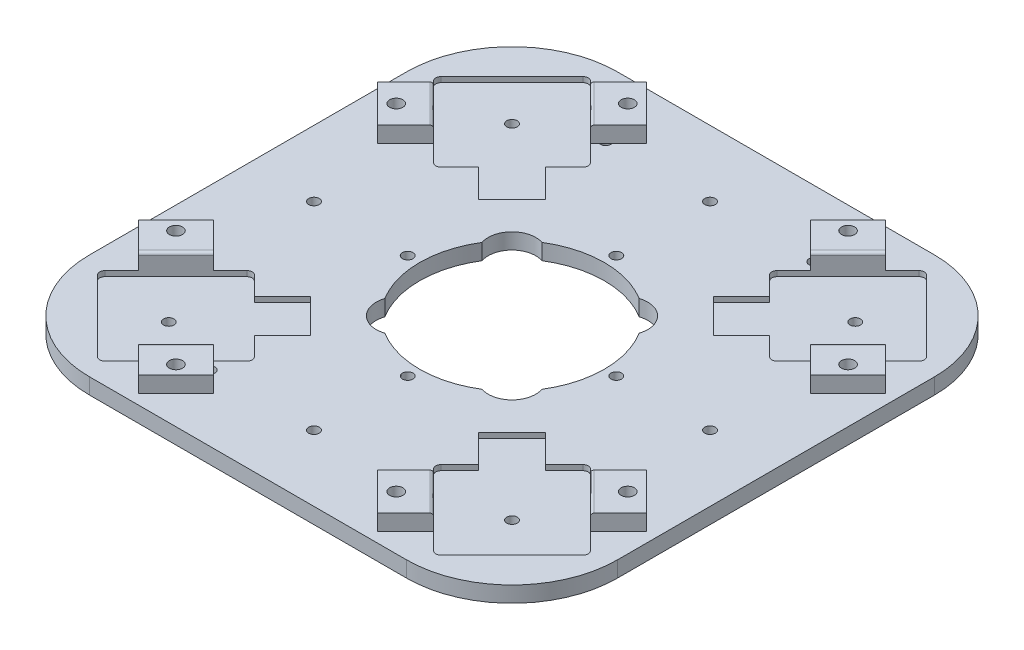
from build123d import *

# Parameters (mm, degrees)
SKETCH_1_W               = 200
SKETCH_1_H               = 200
SKETCH_1_R               = 2
EXTRUDE_1_DEPTH          = 6
CUT_EXTRUDE_1_DEPTH      = 2
FILLET_1_R               = 2
EXTRUDE_3_DEPTH          = 6
FILLET_4_R               = 40
SKETCH_4_R               = 2.5
CUT_EXTRUDE_2_DEPTH      = 8
SKETCH_7_R               = 9
SKETCH_7_W               = 18
SKETCH_7_H               = 8
SKETCH_7_W_2             = 8
SKETCH_7_H_2             = 18
CUT_EXTRUDE_3_DEPTH      = 6
CUT_EXTRUDE_4_DEPTH      = 2
FILLET_6_R               = 1
CUT_EXTRUDE_5_DEPTH      = 142.548578234
CUT_EXTRUDE_5_DEPTH_BACK = 142.548578234
SKETCH_9_R               = 35


with BuildPart() as part:
    # Эскиз1 → Бобышка-Вытянуть1 (new body)
    with BuildSketch(Plane(origin=(0, 0, 0), x_dir=(1, 0, 0), z_dir=(0, 1, 0))):
        Rectangle(SKETCH_1_W, SKETCH_1_H)
        with Locations(Location((-39.5, 75, 0), (0, 0, 270))):
            Circle(SKETCH_1_R, mode=Mode.SUBTRACT)
        with Locations(Location((39.5, 75, 0), (0, 0, 270))):
            Circle(SKETCH_1_R, mode=Mode.SUBTRACT)
        with Locations(Location((39.5, -75, 0), (0, 0, 270))):
            Circle(SKETCH_1_R, mode=Mode.SUBTRACT)
        with Locations(Location((-39.5, -75, 0), (0, 0, 270))):
            Circle(SKETCH_1_R, mode=Mode.SUBTRACT)
        with Locations(Location((39.5, 0, 0), (0, 0, 270))):
            Circle(SKETCH_1_R, mode=Mode.SUBTRACT)
        with Locations(Location((-39.5, 0, 0), (0, 0, 270))):
            Circle(SKETCH_1_R, mode=Mode.SUBTRACT)
        with Locations(Location((0, 39.5, 0), (0, 0, 270))):
            Circle(SKETCH_1_R, mode=Mode.SUBTRACT)
        with Locations(Location((0, -39.5, 0), (0, 0, 90))):
            Circle(SKETCH_1_R, mode=Mode.SUBTRACT)
        with Locations(Location((-75, 0, 0), (0, 0, 270))):
            Circle(SKETCH_1_R, mode=Mode.SUBTRACT)
        with Locations(Location((0, 75, 0), (0, 0, 270))):
            Circle(SKETCH_1_R, mode=Mode.SUBTRACT)
        with Locations(Location((75, 0, 0), (0, 0, 270))):
            Circle(SKETCH_1_R, mode=Mode.SUBTRACT)
        with Locations(Location((0, -75, 0), (0, 0, 270))):
            Circle(SKETCH_1_R, mode=Mode.SUBTRACT)
        with Locations(Location((-65, 65, 0), (0, 0, 270))):
            Circle(SKETCH_1_R, mode=Mode.SUBTRACT)
        with Locations(Location((65, 65, 0), (0, 0, 270))):
            Circle(SKETCH_1_R, mode=Mode.SUBTRACT)
        with Locations(Location((65, -65, 0), (0, 0, 270))):
            Circle(SKETCH_1_R, mode=Mode.SUBTRACT)
        with Locations(Location((-65, -65, 0), (0, 0, 270))):
            Circle(SKETCH_1_R, mode=Mode.SUBTRACT)
    extrude(amount=EXTRUDE_1_DEPTH)

    # Эскиз2 → Вырез-Вытянуть1 (cut)
    with BuildSketch(Plane(origin=(0, 6, 0), x_dir=(1, 0, 0), z_dir=(0, 1, 0))):
        Polygon((63.639610307, 33.941125497), (33.941125497, 63.639610307), (63.639610307, 93.338095117), (93.338095117, 63.639610307), align=None)
        Polygon((33.941125497, -63.639610307), (63.639610307, -33.941125497), (93.338095117, -63.639610307), (63.639610307, -93.338095117), align=None)
        Polygon((-63.639610307, -33.941125497), (-33.941125497, -63.639610307), (-63.639610307, -93.338095117), (-93.338095117, -63.639610307), align=None)
        Polygon((-33.941125497, 63.639610307), (-63.639610307, 33.941125497), (-93.338095117, 63.639610307), (-63.639610307, 93.338095117), align=None)
    extrude(amount=-CUT_EXTRUDE_1_DEPTH, mode=Mode.SUBTRACT)

    # Скругление1
    fillet_1_edges = [part.edges().sort_by_distance(p)[0] for p in [
        (-63.639610307, 5, 93.338095117),
        (-63.639610307, 5, -93.338095117),
        (-33.941125497, 5, -63.639610307),
        (-63.639610307, 5, -33.941125497),
        (-93.338095117, 5, -63.639610307),
        (63.639610307, 5, 93.338095117),
        (33.941125497, 5, 63.639610307),
        (63.639610307, 5, 33.941125497),
        (93.338095117, 5, 63.639610307),
        (93.338095117, 5, -63.639610307),
        (63.639610307, 5, -33.941125497),
        (33.941125497, 5, -63.639610307),
        (63.639610307, 5, -93.338095117),
        (-93.338095117, 5, 63.639610307),
        (-63.639610307, 5, 33.941125497),
        (-33.941125497, 5, 63.639610307),
    ]]
    fillet(fillet_1_edges, radius=FILLET_1_R)

    # Эскиз3 → Бобышка-Вытянуть3 (add)
    with BuildSketch(Plane(origin=(0, 6, 0), x_dir=(1, 0, 0), z_dir=(0, 1, 0))):
        Polygon((41.71930009, 71.4177849), (55.861435714, 85.559920524), (45.254833996, 96.166522241), (31.112698372, 82.024386618), align=None)
        Polygon((85.559920524, 55.861435714), (96.166522241, 45.254833996), (82.024386618, 31.112698372), (71.4177849, 41.71930009), align=None)
        Polygon((71.4177849, -41.71930009), (85.559920524, -55.861435714), (96.166522241, -45.254833996), (82.024386618, -31.112698372), align=None)
        Polygon((31.112698372, -82.024386618), (45.254833996, -96.166522241), (55.861435714, -85.559920524), (41.71930009, -71.4177849), align=None)
        Polygon((-41.71930009, -71.4177849), (-55.861435714, -85.559920524), (-45.254833996, -96.166522241), (-31.112698372, -82.024386618), align=None)
        Polygon((-85.559920524, -55.861435714), (-96.166522241, -45.254833996), (-82.024386618, -31.112698372), (-71.4177849, -41.71930009), align=None)
        Polygon((-71.4177849, 41.71930009), (-85.559920524, 55.861435714), (-96.166522241, 45.254833996), (-82.024386618, 31.112698372), align=None)
        Polygon((-31.112698372, 82.024386618), (-45.254833996, 96.166522241), (-55.861435714, 85.559920524), (-41.71930009, 71.4177849), align=None)
    extrude(amount=EXTRUDE_3_DEPTH)

    # Скругление4
    fillet_4_edges = [part.edges().sort_by_distance(p)[0] for p in [
        (100, 3, 100),
        (-100, 3, 100),
        (-100, 3, -100),
        (100, 3, -100),
    ]]
    fillet(fillet_4_edges, radius=FILLET_4_R)

    # Эскиз4 → Вырез-Вытянуть2 (cut)
    with BuildSketch(Plane(origin=(0, 12, 0), x_dir=(1, 0, 0), z_dir=(0, 1, 0))):
        with Locations(Location((41.71930009, 85.559920524, 0), (0, 0, 270))):
            Circle(SKETCH_4_R)
        with Locations(Location((85.559920524, 41.71930009, 0), (0, 0, 90))):
            Circle(SKETCH_4_R)
        with Locations(Location((85.559920524, -41.71930009, 0), (0, 0, 270))):
            Circle(SKETCH_4_R)
        with Locations(Location((41.71930009, -85.559920524, 0), (0, 0, 90))):
            Circle(SKETCH_4_R)
        with Locations(Location((-41.71930009, -85.559920524, 0), (0, 0, 270))):
            Circle(SKETCH_4_R)
        with Locations(Location((-85.559920524, -41.71930009, 0), (0, 0, 90))):
            Circle(SKETCH_4_R)
        with Locations(Location((-85.559920524, 41.71930009, 0), (0, 0, 270))):
            Circle(SKETCH_4_R)
        with Locations(Location((-41.71930009, 85.559920524, 0), (0, 0, 90))):
            Circle(SKETCH_4_R)
    extrude(amount=-CUT_EXTRUDE_2_DEPTH, mode=Mode.SUBTRACT)

    # Эскиз7 → Вырез-Вытянуть3 (cut)
    with BuildSketch(Plane(origin=(0, 6, 0), x_dir=(1, 0, 0), z_dir=(0, 1, 0))):
        with Locations(Location((21.213203436, 21.213203436, 0), (0, 0, 270))):
            Circle(SKETCH_7_R)
        with Locations(Location((21.213203436, -21.213203436, 0), (0, 0, 270))):
            Circle(SKETCH_7_R)
        with Locations(Location((-21.213203436, -21.213203436, 0), (0, 0, 270))):
            Circle(SKETCH_7_R)
        with Locations(Location((-21.213203436, 21.213203436, 0), (0, 0, 270))):
            Circle(SKETCH_7_R)
        with Locations((24, 0)):
            Rectangle(SKETCH_7_W, SKETCH_7_H)
        with Locations((0, 24)):
            Rectangle(SKETCH_7_W_2, SKETCH_7_H_2)
        with Locations((0, -24)):
            Rectangle(SKETCH_7_W_2, SKETCH_7_H_2)
        with Locations((-24, 0)):
            Rectangle(SKETCH_7_W, SKETCH_7_H)
    extrude(amount=-CUT_EXTRUDE_3_DEPTH, mode=Mode.SUBTRACT)

    # Эскиз8 → Вырез-Вытянуть4 (cut)
    with BuildSketch(Plane(origin=(0, 6, 0), x_dir=(1, 0, 0), z_dir=(0, 1, 0))):
        Polygon((44.547727215, 31.819805153), (31.819805153, 44.547727215), (53.033008589, 65.76093065), (65.76093065, 53.033008589), align=None)
        Polygon((65.76093065, -53.033008589), (53.033008589, -65.76093065), (31.819805153, -44.547727215), (44.547727215, -31.819805153), align=None)
        Polygon((-44.547727215, -31.819805153), (-31.819805153, -44.547727215), (-53.033008589, -65.76093065), (-65.76093065, -53.033008589), align=None)
        Polygon((-65.76093065, 53.033008589), (-53.033008589, 65.76093065), (-31.819805153, 44.547727215), (-44.547727215, 31.819805153), align=None)
    extrude(amount=-CUT_EXTRUDE_4_DEPTH, mode=Mode.SUBTRACT)

    # Скругление6
    fillet_6_edges = [part.edges().sort_by_distance(p)[0] for p in [
        (48.790367902, 12, -78.488852712),
        (78.488852712, 12, -48.790367902),
        (78.488852712, 12, 48.790367902),
        (48.790367902, 12, 78.488852712),
        (-48.790367902, 12, 78.488852712),
        (-78.488852712, 12, 48.790367902),
        (-78.488852712, 12, -48.790367902),
        (-48.790367902, 12, -78.488852712),
    ]]
    fillet(fillet_6_edges, radius=FILLET_6_R)

    # Эскиз9 → Вырез-Вытянуть5 (cut, two sides: drawn at the far end of the back side and taken through both)
    with BuildSketch(Plane(origin=(0, 6, 0), x_dir=(1, 0, 0), z_dir=(0, 1, 0)).offset(-CUT_EXTRUDE_5_DEPTH_BACK)):
        Circle(SKETCH_9_R)
    extrude(amount=CUT_EXTRUDE_5_DEPTH + CUT_EXTRUDE_5_DEPTH_BACK, mode=Mode.SUBTRACT)


solid = part.part
